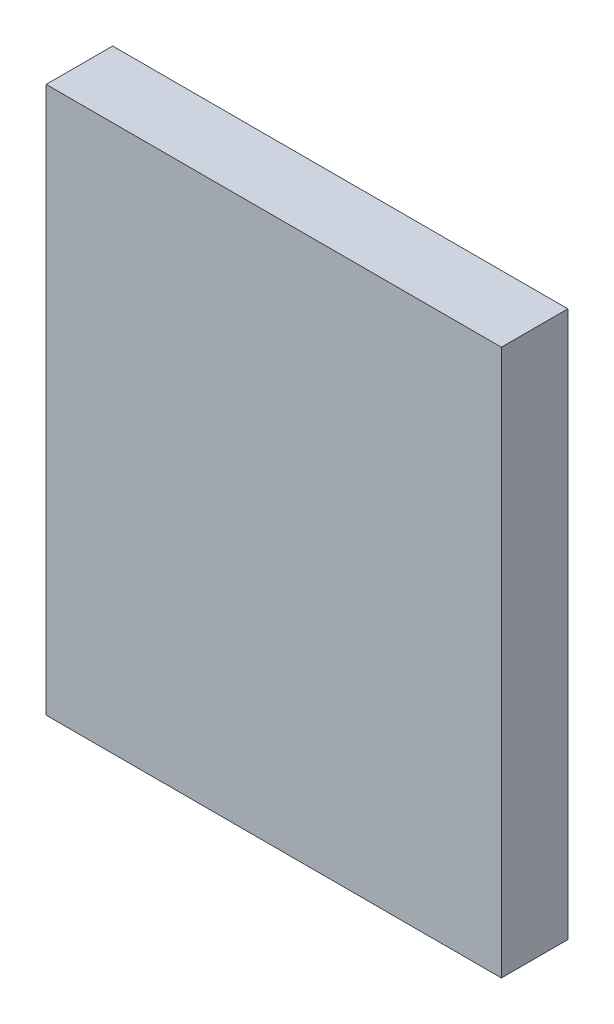
from build123d import *

# Parameters (mm, degrees)
SKETCH3_W           = 50
SKETCH3_H           = 60
BOSS_EXTRUDE1_DEPTH = 7.3


with BuildPart() as part:
    # Sketch3 → Boss-Extrude1 (new body)
    with BuildSketch(Plane.XY):
        Rectangle(SKETCH3_W, SKETCH3_H)
    extrude(amount=BOSS_EXTRUDE1_DEPTH)


solid = part.part
